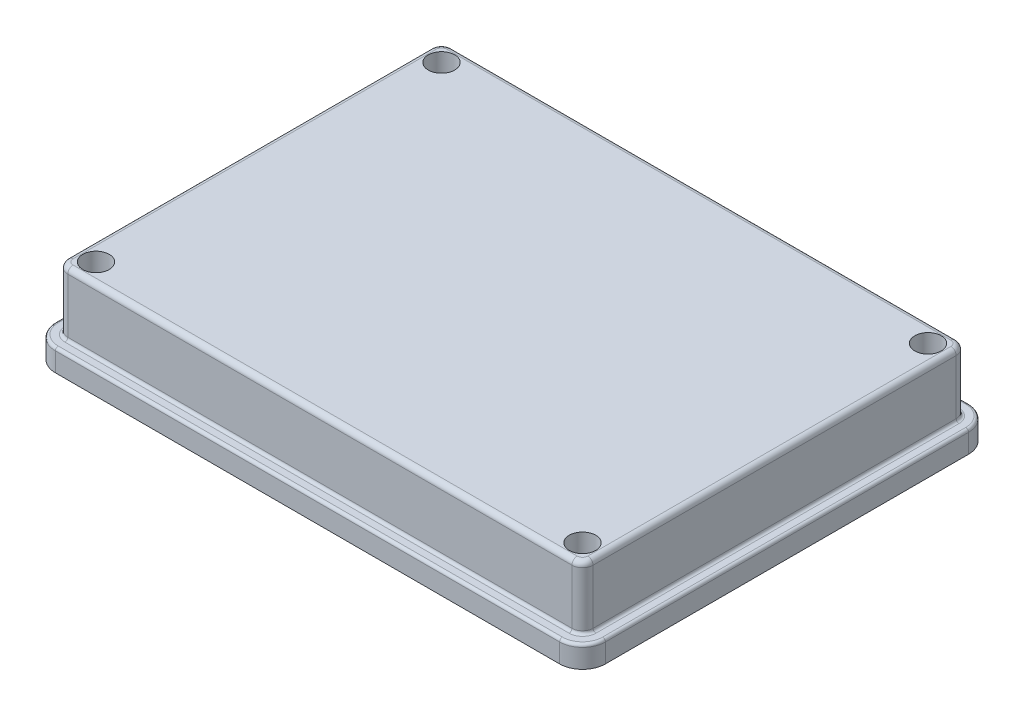
from build123d import *

# Parameters (mm, degrees)
BOSS_EXTRUDE1_DEPTH                     = 24
FILLET1_R                               = 1.5
SHELL1_T                                = -2
BOSS_EXTRUDE2_DEPTH                     = 6.2
CUT_EXTRUDE1_DEPTH                      = 5
FILLET2_R                               = 0.8
BOSS_EXTRUDE4_START                     = -1
SKETCH4_R                               = 5
BOSS_EXTRUDE4_DEPTH                     = 23
CBORE_FOR_M5_HEX_HEAD_BOLT1_D           = 3.7
CBORE_FOR_M5_HEX_HEAD_BOLT1_CBORE_D     = 7.5
CBORE_FOR_M5_HEX_HEAD_BOLT1_CBORE_DEPTH = 12


with BuildPart() as part:
    # Sketch1 → Boss-Extrude1 (new body)
    with BuildSketch(Plane(origin=(0, 0, 0), x_dir=(1, 0, 0), z_dir=(0, 1, 0))):
        with BuildLine():
            Line((74.5, -51.5), (74.5, 51.5))
            ThreePointArc((74.5, 51.5), (73.621320344, 53.621320344), (71.5, 54.5))
            Line((71.5, 54.5), (-71.5, 54.5))
            ThreePointArc((-71.5, 54.5), (-73.621320344, 53.621320344), (-74.5, 51.5))
            Line((-74.5, 51.5), (-74.5, -51.5))
            ThreePointArc((-74.5, -51.5), (-73.621320344, -53.621320344), (-71.5, -54.5))
            Line((-71.5, -54.5), (71.5, -54.5))
            ThreePointArc((71.5, -54.5), (73.621320344, -53.621320344), (74.5, -51.5))
        make_face()
    extrude(amount=BOSS_EXTRUDE1_DEPTH)

    # Fillet1
    fillet1_edges = [part.edges().sort_by_distance(p)[0] for p in [
        (-73.621320344, 24, -53.621320344),
        (-74.5, 24, 0),
        (-73.621320344, 24, 53.621320344),
        (0, 24, 54.5),
        (73.621320344, 24, 53.621320344),
        (74.5, 24, 0),
        (73.621320344, 24, -53.621320344),
        (0, 24, -54.5),
    ]]
    fillet(fillet1_edges, radius=FILLET1_R)

    # Shell1
    shell1_openings = [part.faces().sort_by_distance(p)[0] for p in [
        (0, 0, 0),
    ]]
    offset(amount=SHELL1_T, openings=shell1_openings, kind=Kind.INTERSECTION)

    # Sketch2 → Boss-Extrude2 (add)
    with BuildSketch(Plane(origin=(0, 0, 0), x_dir=(1, 0, 0), z_dir=(0, 1, 0))):
        with BuildLine():
            Line((-78, 51.5), (-78, -51.5))
            ThreePointArc((-78, -51.5), (-76.096194078, -56.096194078), (-71.5, -58))
            Line((-71.5, -58), (71.5, -58))
            ThreePointArc((71.5, -58), (76.096194078, -56.096194078), (78, -51.5))
            Line((78, -51.5), (78, 51.5))
            ThreePointArc((78, 51.5), (76.096194078, 56.096194078), (71.5, 58))
            Line((71.5, 58), (-71.5, 58))
            ThreePointArc((-71.5, 58), (-76.096194078, 56.096194078), (-78, 51.5))
        make_face()
        with BuildLine():
            Line((72.5, -51.5), (72.5, 51.5))
            ThreePointArc((72.5, 51.5), (72.207106781, 52.207106781), (71.5, 52.5))
            Line((71.5, 52.5), (-71.5, 52.5))
            ThreePointArc((-71.5, 52.5), (-72.207106781, 52.207106781), (-72.5, 51.5))
            Line((-72.5, 51.5), (-72.5, -51.5))
            ThreePointArc((-72.5, -51.5), (-72.207106781, -52.207106781), (-71.5, -52.5))
            Line((-71.5, -52.5), (71.5, -52.5))
            ThreePointArc((71.5, -52.5), (72.207106781, -52.207106781), (72.5, -51.5))
        make_face(mode=Mode.SUBTRACT)
    extrude(amount=BOSS_EXTRUDE2_DEPTH)

    # Sketch3 → Cut-Extrude1 (cut)
    with BuildSketch(Plane.XZ):
        with BuildLine():
            Line((-71.5, -56.5), (71.5, -56.5))
            ThreePointArc((71.5, -56.5), (75.035533906, -55.035533906), (76.5, -51.5))
            Line((76.5, -51.5), (76.5, 51.5))
            ThreePointArc((76.5, 51.5), (75.035533906, 55.035533906), (71.5, 56.5))
            Line((71.5, 56.5), (-71.5, 56.5))
            ThreePointArc((-71.5, 56.5), (-75.035533906, 55.035533906), (-76.5, 51.5))
            Line((-76.5, 51.5), (-76.5, -51.5))
            ThreePointArc((-76.5, -51.5), (-75.035533906, -55.035533906), (-71.5, -56.5))
        make_face()
        with BuildLine():
            Line((74, -51.5), (74, 51.5))
            ThreePointArc((74, 51.5), (73.267766953, 53.267766953), (71.5, 54))
            Line((71.5, 54), (-71.5, 54))
            ThreePointArc((-71.5, 54), (-73.267766953, 53.267766953), (-74, 51.5))
            Line((-74, 51.5), (-74, -51.5))
            ThreePointArc((-74, -51.5), (-73.267766953, -53.267766953), (-71.5, -54))
            Line((-71.5, -54), (71.5, -54))
            ThreePointArc((71.5, -54), (73.267766953, -53.267766953), (74, -51.5))
        make_face(mode=Mode.SUBTRACT)
    extrude(amount=-CUT_EXTRUDE1_DEPTH, mode=Mode.SUBTRACT)

    # Fillet2
    fillet2_edges = [part.edges().sort_by_distance(p)[0] for p in [
        (-76.096194078, 6.2, -56.096194078),
        (-78, 6.2, 0),
        (-76.096194078, 6.2, 56.096194078),
        (0, 6.2, 58),
        (76.096194078, 6.2, 56.096194078),
        (78, 6.2, 0),
        (76.096194078, 6.2, -56.096194078),
        (0, 6.2, -58),
        (74.5, 6.2, 0),
        (73.621320344, 6.2, -53.621320344),
        (0, 6.2, -54.5),
        (-73.621320344, 6.2, -53.621320344),
        (-74.5, 6.2, 0),
        (-73.621320344, 6.2, 53.621320344),
        (0, 6.2, 54.5),
        (73.621320344, 6.2, 53.621320344),
    ]]
    fillet(fillet2_edges, radius=FILLET2_R)

    # Sketch4 → Boss-Extrude4 (add)
    with BuildSketch(Plane(origin=(0, 24, 0), x_dir=(1, 0, 0), z_dir=(0, 1, 0)).offset(BOSS_EXTRUDE4_START)):
        with Locations((69, 49)):
            Circle(SKETCH4_R)
        with Locations((69, -49)):
            Circle(SKETCH4_R)
        with Locations((-69, 49)):
            Circle(SKETCH4_R)
        with Locations((-69, -49)):
            Circle(SKETCH4_R)
    extrude(amount=-BOSS_EXTRUDE4_DEPTH)

    # CBORE for M5 Hex Head Bolt1 (through all)
    with Locations(Plane(origin=(0, 24, 0), x_dir=(1, 0, 0), z_dir=(0, 1, 0))):
        with Locations((-69, -49), (69, -49), (-69, 49), (69, 49)):
            CounterBoreHole(CBORE_FOR_M5_HEX_HEAD_BOLT1_D / 2, CBORE_FOR_M5_HEX_HEAD_BOLT1_CBORE_D / 2, CBORE_FOR_M5_HEX_HEAD_BOLT1_CBORE_DEPTH)


solid = part.part
